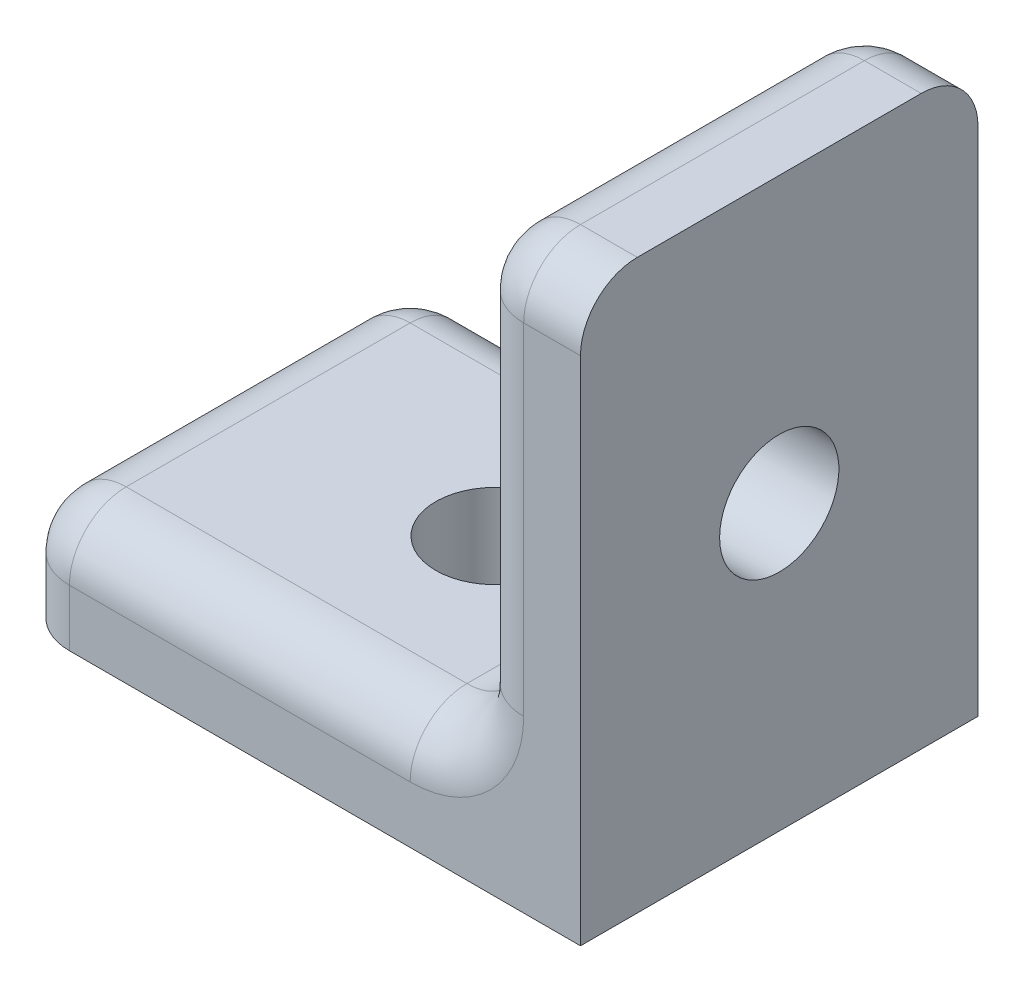
from build123d import *

# Parameters (mm, degrees)
SKETCH1_W           = 10
SKETCH1_H           = 7
BOSS_EXTRUDE1_DEPTH = 2
SKETCH2_W           = 7
SKETCH2_H           = 10
BOSS_EXTRUDE2_DEPTH = 2
SKETCH3_R           = 1.05
CUT_EXTRUDE1_DEPTH  = 14.275918047
SKETCH4_R           = 1.05
CUT_EXTRUDE2_DEPTH  = 14.275918047
FILLET1_R           = 1


with BuildPart() as part:
    # Sketch1 → Boss-Extrude1 (new body)
    with BuildSketch(Plane(origin=(0, 0, 0), x_dir=(1, 0, 0), z_dir=(0, 1, 0))):
        with Locations((-5, 0)):
            Rectangle(SKETCH1_W, SKETCH1_H)
    extrude(amount=BOSS_EXTRUDE1_DEPTH)

    # Sketch2 → Boss-Extrude2 (add)
    with BuildSketch(Plane(origin=(0, 0, 0), x_dir=(0, 0, -1), z_dir=(1, 0, 0))):
        with Locations((0, 5)):
            Rectangle(SKETCH2_W, SKETCH2_H)
    extrude(amount=-BOSS_EXTRUDE2_DEPTH)

    # Sketch3 → Cut-Extrude1 (cut, through all)
    with BuildSketch(Plane(origin=(0, 2, 0), x_dir=(1, 0, 0), z_dir=(0, 1, 0))):
        with Locations((-5, 0)):
            Circle(SKETCH3_R)
    extrude(amount=-CUT_EXTRUDE1_DEPTH, mode=Mode.SUBTRACT)

    # Sketch4 → Cut-Extrude2 (cut, through all)
    with BuildSketch(Plane.ZY.offset(2)):
        with Locations((0, 5)):
            Circle(SKETCH4_R)
    extrude(amount=-CUT_EXTRUDE2_DEPTH, mode=Mode.SUBTRACT)

    # Fillet1
    fillet1_edges = [part.edges().sort_by_distance(p)[0] for p in [
        (-2, 2, 0),
        (-6, 2, 3.5),
        (-2, 6, 3.5),
        (-2, 10, 0),
        (-6, 2, -3.5),
        (-2, 6, -3.5),
        (-10, 1, -3.5),
        (-10, 1, 3.5),
        (-1, 10, 3.5),
        (-1, 10, -3.5),
        (-10, 2, 0),
    ]]
    fillet(fillet1_edges, radius=FILLET1_R)


solid = part.part
